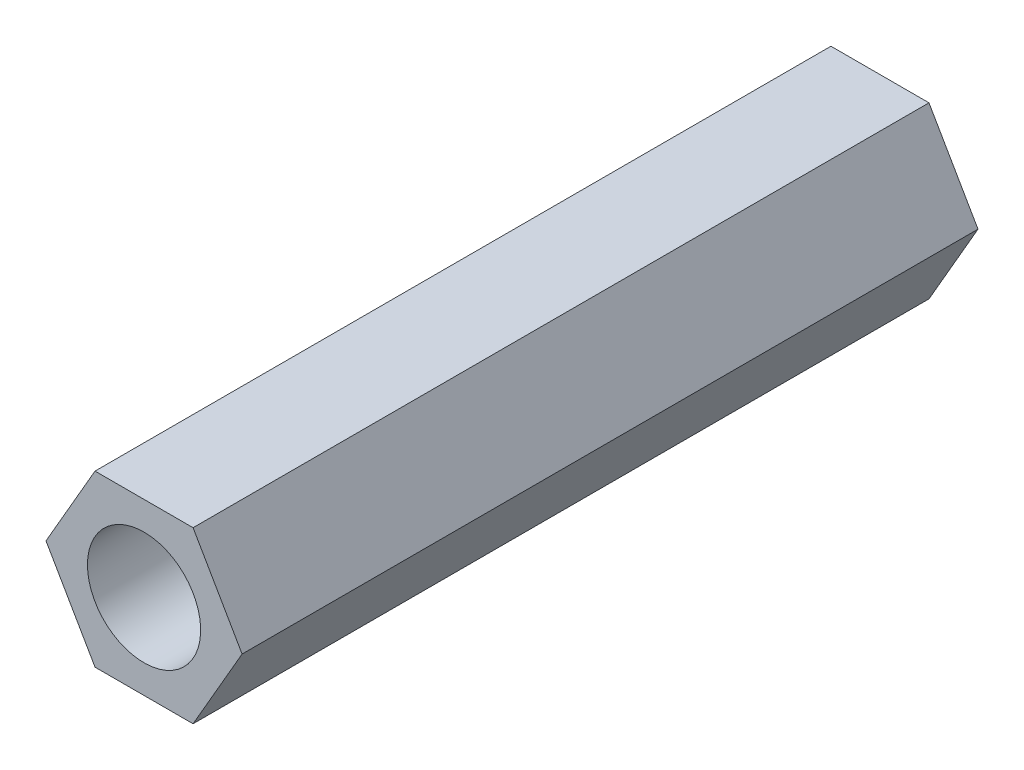
from build123d import *

# Parameters (mm, degrees)
SKETCH_1_R      = 1
EXTRUDE_1_DEPTH = 13


with BuildPart() as part:
    # 草图1 → 凸台-拉伸1 (new body)
    with BuildSketch(Plane.XY):
        Polygon((1.732050808, 0), (0.866025404, 1.5), (-0.866025404, 1.5), (-1.732050808, 0), (-0.866025404, -1.5), (0.866025404, -1.5), align=None)
        with Locations(Location((0, 0, 0), (0, 0, 180))):
            Circle(SKETCH_1_R, mode=Mode.SUBTRACT)
    extrude(amount=EXTRUDE_1_DEPTH)


solid = part.part
